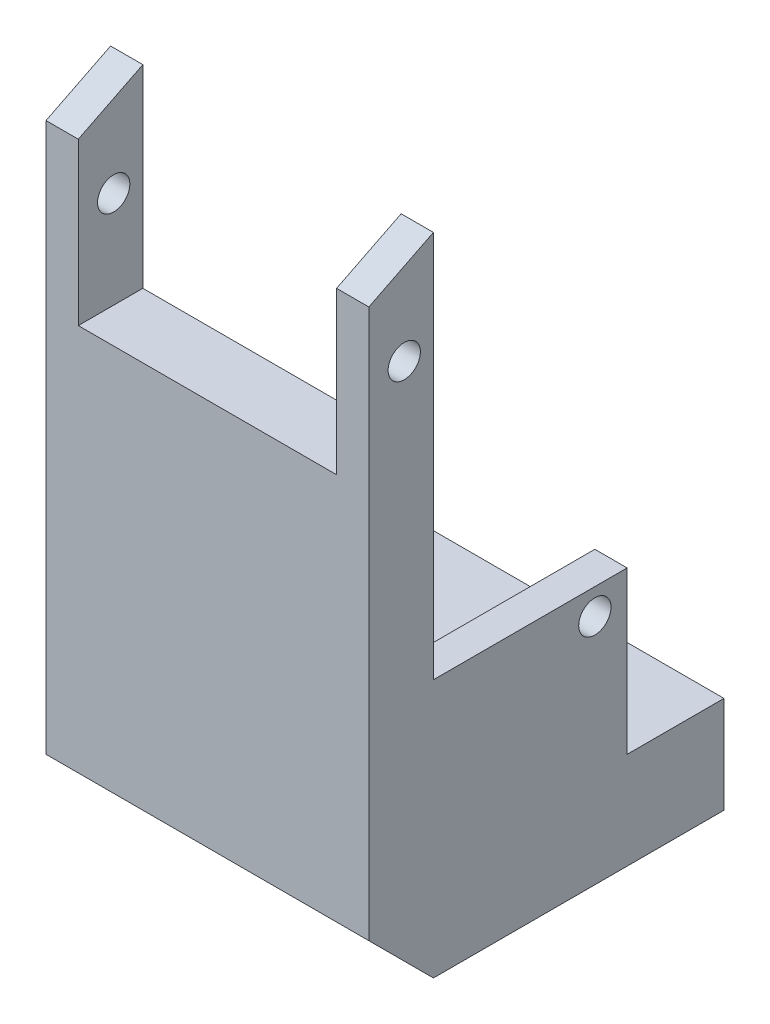
from build123d import *

# Parameters (mm, degrees)
SKETCH_1_W                = 5
SKETCH_1_H                = 10
EXTRUDE_1_DEPTH           = 4
CUT_EXTRUDE_1_DEPTH       = 9.124038405
CUT_EXTRUDE_1_DEPTH_BACK  = 9.124038405
CUT_EXTRUDE_2_DEPTH       = 9.124038405
CUT_EXTRUDE_2_DEPTH_BACK  = 9.124038405
SKETCH_6_W                = 4
SKETCH_6_H                = 3
CUT_EXTRUDE_3_DEPTH       = 2.5
SKETCH_7_W                = 4
SKETCH_7_H                = 3
CUT_EXTRUDE_4_DEPTH       = 2.5
CUT_EXTRUDE_5_DEPTH       = 9.124038405
CUT_EXTRUDE_5_DEPTH_BACK  = 9.124038405
CUT_EXTRUDE_10_DEPTH      = 9.124038405
CUT_EXTRUDE_10_DEPTH_BACK = 5
SKETCH_11_R               = 0.25
CUT_EXTRUDE_11_DEPTH      = 5
SKETCH_12_R               = 0.25
CUT_EXTRUDE_12_DEPTH      = 5
EXTRUDE_3_DEPTH           = 5
SCALE_1_SCALE             = 2.454545455


with BuildPart() as part:
    # 草图1 → 凸台-拉伸1 (new body)
    with BuildSketch(Plane.XY):
        Rectangle(SKETCH_1_W, SKETCH_1_H)
    extrude(amount=EXTRUDE_1_DEPTH)

    # 草图2 → 切除-拉伸1 (cut, two sides: drawn at the far end of the back side and taken through both)
    with BuildSketch(Plane(origin=(2.5, 0, 0), x_dir=(0, 0, -1), z_dir=(1, 0, 0)).offset(-CUT_EXTRUDE_1_DEPTH_BACK)):
        Polygon((-31.620459958, -9.310229979), (-4, 4.5), (-3, 5), (24.620459958, 18.810229979), (-3, 74.051149895), (-59.240919916, 45.930689937), align=None)
    extrude(amount=CUT_EXTRUDE_1_DEPTH + CUT_EXTRUDE_1_DEPTH_BACK, mode=Mode.SUBTRACT)

    # 草图3 → 切除-拉伸2 (cut, two sides: drawn at the far end of the back side and taken through both)
    with BuildSketch(Plane(origin=(2.5, 0, 0), x_dir=(0, 0, -1), z_dir=(1, 0, 0)).offset(-CUT_EXTRUDE_2_DEPTH_BACK)):
        Polygon((-3, 35.880613018), (-3, 5), (-3, -1), (0, -1), (30.880613018, -1), (76.363050598, 40.782734631), (42.48243758, 77.663347649), align=None)
    extrude(amount=CUT_EXTRUDE_2_DEPTH + CUT_EXTRUDE_2_DEPTH_BACK, mode=Mode.SUBTRACT)

    # 草图6 → 切除-拉伸3 (cut)
    with BuildSketch(Plane(origin=(0, -1, 0), x_dir=(1, 0, 0), z_dir=(0, 1, 0))):
        with Locations((0, -1.5)):
            Rectangle(SKETCH_6_W, SKETCH_6_H)
    extrude(amount=-CUT_EXTRUDE_3_DEPTH, mode=Mode.SUBTRACT)

    # 草图7 → 切除-拉伸4 (cut)
    with BuildSketch(Plane(origin=(0, 0, 3), x_dir=(-1, 0, 0), z_dir=(0, 0, -1))):
        with Locations((0, 3.5)):
            Rectangle(SKETCH_7_W, SKETCH_7_H)
    extrude(amount=-CUT_EXTRUDE_4_DEPTH, mode=Mode.SUBTRACT)

    # 草图8 → 切除-拉伸5 (cut, two sides: drawn at the far end of the back side and taken through both)
    with BuildSketch(Plane(origin=(2.5, 0, 0), x_dir=(0, 0, -1), z_dir=(1, 0, 0)).offset(-CUT_EXTRUDE_5_DEPTH_BACK)):
        Polygon((-25.835890872, 17.835890872), (-4, -4), (-3, -5), (18.835890872, -26.835890872), (-24.835890872, -70.507672616), (-69.507672616, -25.835890872), align=None)
    extrude(amount=CUT_EXTRUDE_5_DEPTH + CUT_EXTRUDE_5_DEPTH_BACK, mode=Mode.SUBTRACT)

    # 草图9 → 切除-拉伸10 (cut, two sides: drawn at the far end of the back side and taken through both)
    with BuildSketch(Plane(origin=(2.5, 0, 0), x_dir=(0, 0, -1), z_dir=(1, 0, 0)).offset(-CUT_EXTRUDE_10_DEPTH_BACK)):
        Polygon((-23.148447549, -26.648447549), (-1.5, -5), (0, -3.5), (21.648447549, 18.148447549), (64.945342647, -25.148447549), (20.148447549, -69.945342647), align=None)
    extrude(amount=CUT_EXTRUDE_10_DEPTH + CUT_EXTRUDE_10_DEPTH_BACK, mode=Mode.SUBTRACT)

    # 草图11 → 切除-拉伸11 (cut)
    with BuildSketch(Plane(origin=(2.5, 0, 0), x_dir=(0, 0, -1), z_dir=(1, 0, 0))):
        with Locations((-3.451895846, 3.5)):
            Circle(SKETCH_11_R)
    extrude(amount=-CUT_EXTRUDE_11_DEPTH, mode=Mode.SUBTRACT)

    # 草图12 → 切除-拉伸12 (cut)
    with BuildSketch(Plane(origin=(2.5, 0, 0), x_dir=(0, 0, -1), z_dir=(1, 0, 0))):
        with Locations((-0.5, -1.4)):
            Circle(SKETCH_12_R)
    extrude(amount=-CUT_EXTRUDE_12_DEPTH, mode=Mode.SUBTRACT)

    # 草图14 → 凸台-拉伸3 (add)
    with BuildSketch(Plane.ZY.offset(2.5)):
        Polygon((1.5, -5), (-1.5, -5), (-1.5, -3.5), (0, -3.5), align=None)
    extrude(amount=-EXTRUDE_3_DEPTH)


with BuildPart() as part_1:
    # 缩放比例1: scaled about (0, -2.526255673, 2.085256103)
    add(part.part.scale(SCALE_1_SCALE).moved(Location((0, 3.674553706, -3.033099786))))


solid = part_1.part
